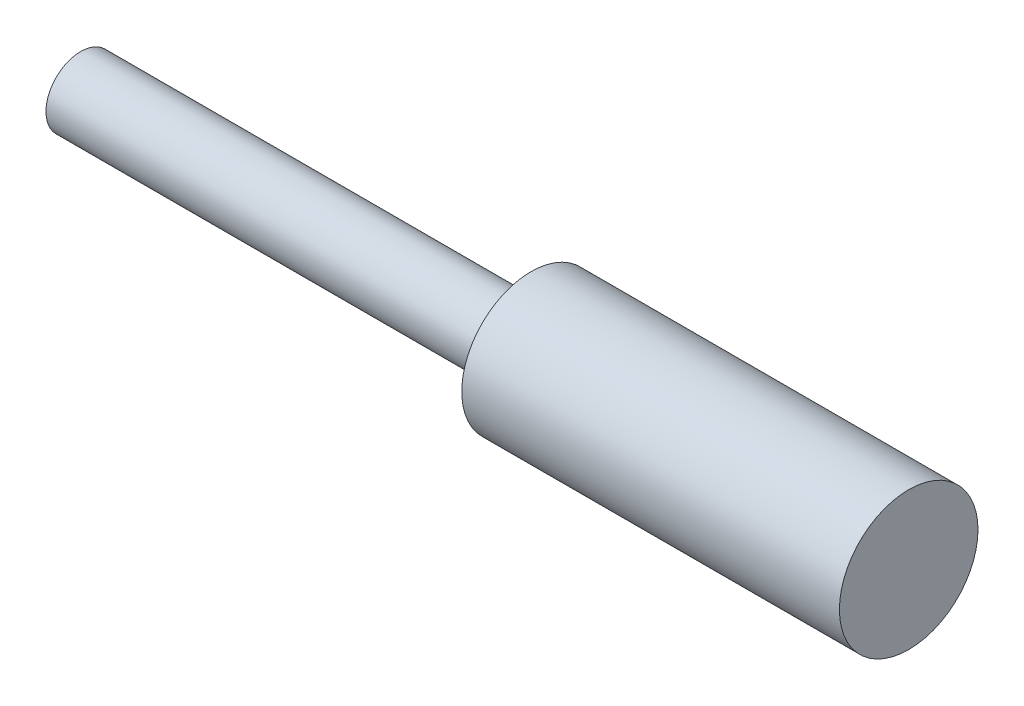
from build123d import *

# Parameters (mm, degrees)
SKETCH3_R           = 3
BASE_EXTRUDE_DEPTH  = 71.7
SKETCH4_R           = 6
BOSS_EXTRUDE1_DEPTH = 32.7


with BuildPart() as part:
    # Sketch3 → Base-Extrude (new body)
    with BuildSketch(Plane.ZY.offset(-2657.738357409)):
        with Locations((22.5744, 11.5)):
            Circle(SKETCH3_R)
    extrude(amount=-BASE_EXTRUDE_DEPTH)

    # Sketch4 → Boss-Extrude1 (add)
    with BuildSketch(Plane.ZY.offset(-2729.438357409)):
        with Locations(Location((22.5744, 11.5, 0), (0, 0, 180))):
            Circle(SKETCH4_R)
    extrude(amount=BOSS_EXTRUDE1_DEPTH)


solid = part.part
